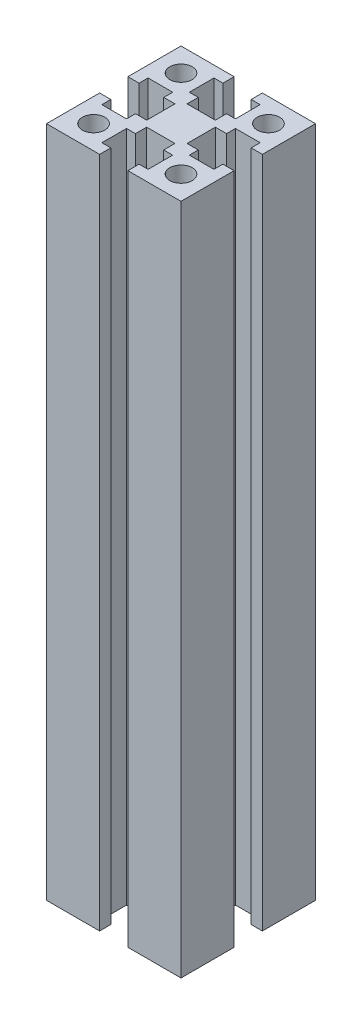
from build123d import *

# Parameters (mm, degrees)
SKETCH_1_R          = 2.5
EXTRUDE_1_DEPTH     = 180
SKETCH_2_R          = 82.250528809
CUT_EXTRUDE_1_DEPTH = 10
SKETCH_3_R          = 47.359827943
CUT_EXTRUDE_2_DEPTH = 200


with BuildPart() as part:
    # 草图1 → 凸台-拉伸1 (new, symmetric)
    with BuildSketch(Plane(origin=(0, 0, 0), x_dir=(1, 0, 0), z_dir=(0, 1, 0))):
        Polygon((-15, -3.15), (-12.5, -3.15), (-12.5, -5.15), (-7, -5.15), (-7, -3.15), (-4.5, -3.15), (-4.5, 3.15), (-7, 3.15), (-7, 5.15), (-12.5, 5.15), (-12.5, 3.15), (-15, 3.15), (-15, 15), (-3.15, 15), (-3.15, 12.5), (-5.15, 12.5), (-5.15, 7), (-3.15, 7), (-3.15, 4.5), (3.15, 4.5), (3.15, 7), (5.15, 7), (5.15, 12.5), (3.15, 12.5), (3.15, 15), (15, 15), (15, 3.15), (12.5, 3.15), (12.5, 5.15), (7, 5.15), (7, 3.15), (4.5, 3.15), (4.5, -3.15), (7, -3.15), (7, -5.15), (12.5, -5.15), (12.5, -3.15), (15, -3.15), (15, -15), (3.15, -15), (3.15, -12.5), (5.15, -12.5), (5.15, -7), (3.15, -7), (3.15, -4.5), (-3.15, -4.5), (-3.15, -7), (-5.15, -7), (-5.15, -12.5), (-3.15, -12.5), (-3.15, -15), (-15, -15), align=None)
        with Locations(Location((-9.75, -9.75, 0), (0, 0, 90))):
            Circle(SKETCH_1_R, mode=Mode.SUBTRACT)
        with Locations(Location((-9.75, 9.75, 0), (0, 0, 90))):
            Circle(SKETCH_1_R, mode=Mode.SUBTRACT)
        with Locations(Location((9.75, 9.75, 0), (0, 0, 90))):
            Circle(SKETCH_1_R, mode=Mode.SUBTRACT)
        with Locations(Location((9.75, -9.75, 0), (0, 0, 90))):
            Circle(SKETCH_1_R, mode=Mode.SUBTRACT)
    extrude(amount=EXTRUDE_1_DEPTH, both=True)

    # 草图2 → 切除-拉伸1 (cut)
    with BuildSketch(Plane(origin=(0, 180, 0), x_dir=(1, 0, 0), z_dir=(0, 1, 0))):
        Circle(SKETCH_2_R)
    extrude(amount=-CUT_EXTRUDE_1_DEPTH, mode=Mode.SUBTRACT)

    # 草图3 → 切除-拉伸2 (cut)
    with BuildSketch(Plane.XZ.offset(180)):
        with Locations((0.216432031, -1.772037256)):
            Circle(SKETCH_3_R)
    extrude(amount=-CUT_EXTRUDE_2_DEPTH, mode=Mode.SUBTRACT)


solid = part.part
